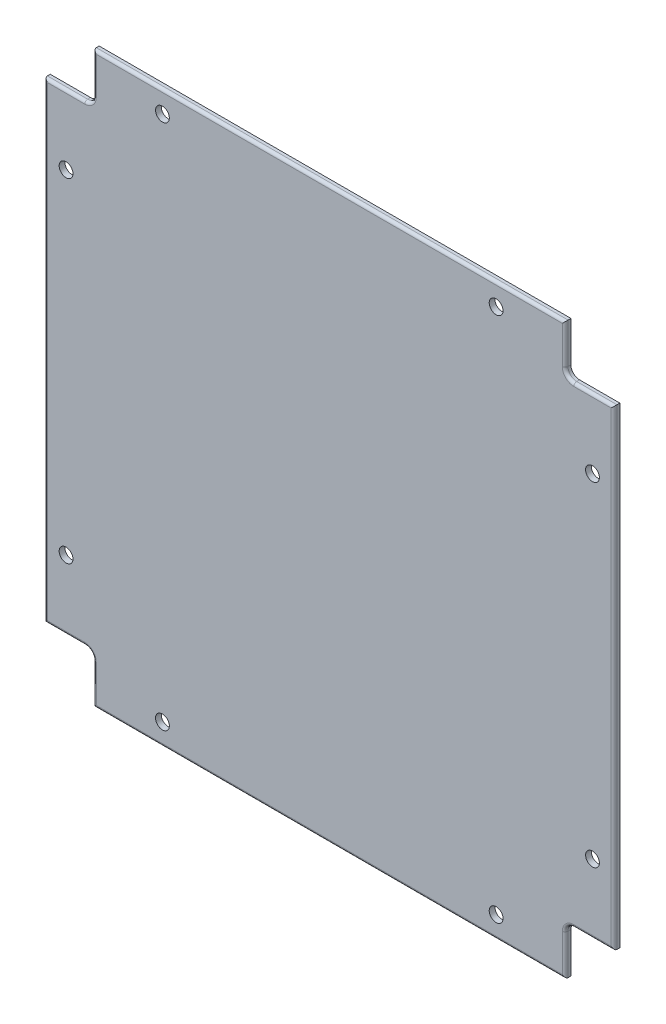
from build123d import *

# Parameters (mm, degrees)
SKETCH1_W           = 99
SKETCH1_H           = 99
BOSS_EXTRUDE1_DEPTH = 0.5
CUT_EXTRUDE1_DEPTH  = 71.010713466
M2_HOLE1_B_D        = 2.4
M2_HOLE1_B_DEPTH    = 3
M2_HOLE1_B_TIP      = 0.721032743
FILLET1_R           = 0.5


with BuildPart() as part:
    # Sketch1 → Boss-Extrude1 (new, symmetric)
    with BuildSketch(Plane.XY):
        Rectangle(SKETCH1_W, SKETCH1_H)
    extrude(amount=BOSS_EXTRUDE1_DEPTH, both=True)

    # Sketch2 → Cut-Extrude1 (cut, through all)
    with BuildSketch(Plane.XY.offset(0.5)):
        with BuildLine():
            Line((-49.5, 49.5), (-41, 49.5))
            Line((-41, 49.5), (-41, 42.5))
            ThreePointArc((-41, 42.5), (-41.439339828, 41.439339828), (-42.5, 41))
            Line((-42.5, 41), (-49.5, 41))
            Line((-49.5, 41), (-49.5, 49.5))
        make_face()
        with BuildLine():
            Line((49.5, 49.5), (41, 49.5))
            Line((41, 49.5), (41, 42.5))
            ThreePointArc((41, 42.5), (41.439339828, 41.439339828), (42.5, 41))
            Line((42.5, 41), (49.5, 41))
            Line((49.5, 41), (49.5, 49.5))
        make_face()
        with BuildLine():
            Line((-49.5, -49.5), (-41, -49.5))
            Line((-41, -49.5), (-41, -42.5))
            ThreePointArc((-41, -42.5), (-41.439339828, -41.439339828), (-42.5, -41))
            Line((-42.5, -41), (-49.5, -41))
            Line((-49.5, -41), (-49.5, -49.5))
        make_face()
        with BuildLine():
            Line((49.5, -49.5), (41, -49.5))
            Line((41, -49.5), (41, -42.5))
            ThreePointArc((41, -42.5), (41.439339828, -41.439339828), (42.5, -41))
            Line((42.5, -41), (49.5, -41))
            Line((49.5, -41), (49.5, -49.5))
        make_face()
    extrude(amount=-CUT_EXTRUDE1_DEPTH, mode=Mode.SUBTRACT)

    # M2 Hole1 - B
    with Locations(Plane.XY.offset(0.5)):
        with Locations((-45.75, 29), (-29, 45.75), (29, 45.75), (45.75, 29), (45.75, -29), (29, -45.75), (-29, -45.75), (-45.75, -29)):
            Hole(M2_HOLE1_B_D / 2, depth=M2_HOLE1_B_DEPTH)
            with Locations((0, 0, -(M2_HOLE1_B_DEPTH + M2_HOLE1_B_TIP / 2))):  # 118° drill point
                Cone(0, M2_HOLE1_B_D / 2, M2_HOLE1_B_TIP, mode=Mode.SUBTRACT)

    # Fillet1
    fillet1_edges = [part.edges().sort_by_distance(p)[0] for p in [
        (-49.5, 0, 0.5),
        (-46, 41, 0.5),
        (-41.439339828, 41.439339828, 0.5),
        (-41, 46, 0.5),
        (0, 49.5, 0.5),
        (41.439339828, 41.439339828, 0.5),
        (46, 41, 0.5),
        (41, 46, 0.5),
        (49.5, 0, 0.5),
        (41.439339828, -41.439339828, 0.5),
        (41, -46, 0.5),
        (46, -41, 0.5),
        (0, -49.5, 0.5),
        (-41, -46, 0.5),
        (-41.439339828, -41.439339828, 0.5),
        (-46, -41, 0.5),
    ]]
    fillet(fillet1_edges, radius=FILLET1_R)


solid = part.part
